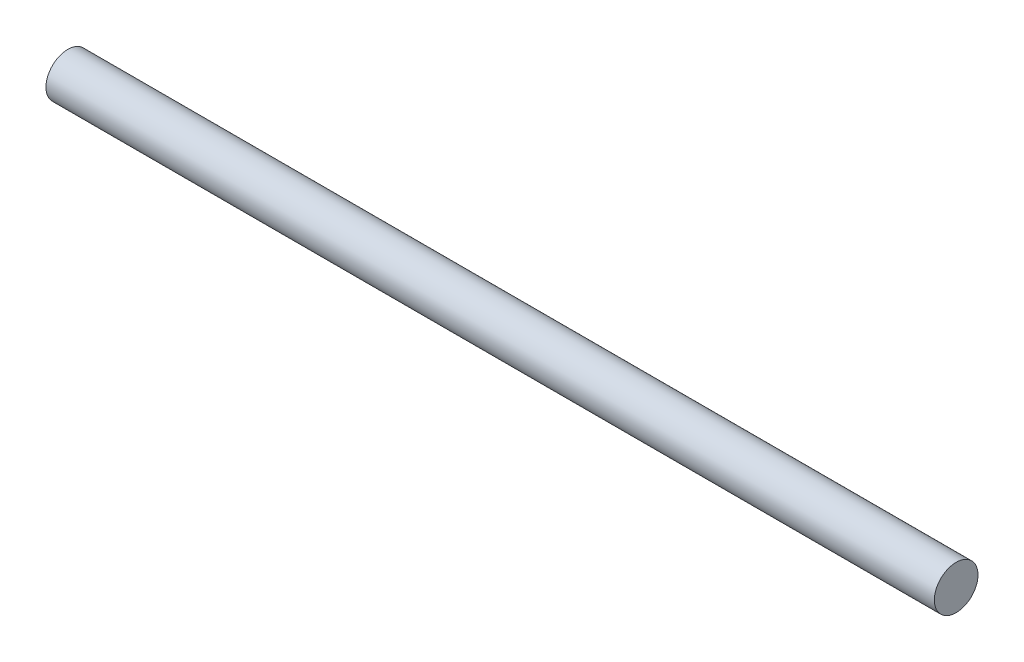
from build123d import *

# Parameters (mm, degrees)
EXTRUDE1_DEPTH      = 25
EXTRUDE1_DEPTH_BACK = 25
SKETCH1_R           = 1.228981018


with BuildPart() as part:
    # Sketch1 → Extrude1 (new, two sides: drawn at the far end of the back side and taken through both)
    with BuildSketch(Plane(origin=(0, 0, 0), x_dir=(0, 0, -1), z_dir=(1, 0, 0)).offset(-EXTRUDE1_DEPTH_BACK)):
        Circle(SKETCH1_R)
    extrude(amount=EXTRUDE1_DEPTH + EXTRUDE1_DEPTH_BACK)


solid = part.part
